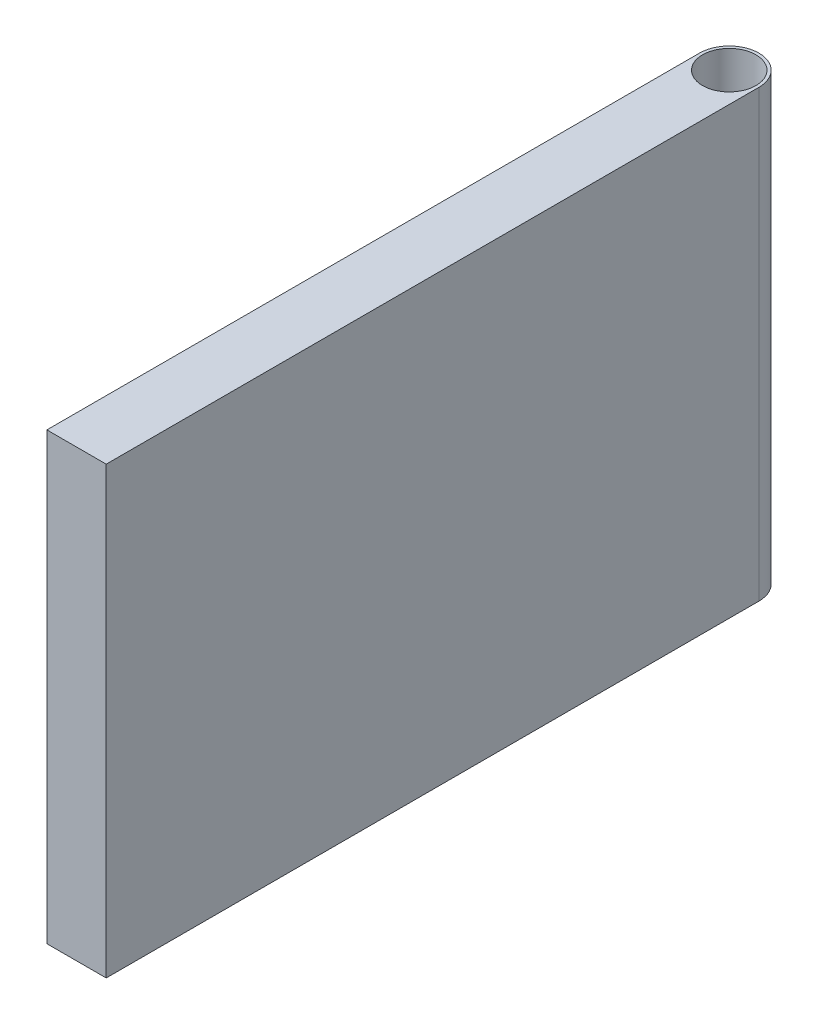
from build123d import *

# Parameters (mm, degrees)
SKETCH1_W           = 220
SKETCH1_H           = 150
BOSS_EXTRUDE2_DEPTH = 20
SKETCH3_R           = 10
SKETCH3_R_2         = 9
BOSS_EXTRUDE3_DEPTH = 150
SKETCH4_R           = 9
CUT_EXTRUDE1_DEPTH  = 150


with BuildPart() as part:
    # Sketch1 → Boss-Extrude2 (new body)
    with BuildSketch(Plane(origin=(0, 0, 0), x_dir=(0, 0, -1), z_dir=(1, 0, 0))):
        Rectangle(SKETCH1_W, SKETCH1_H)
    extrude(amount=BOSS_EXTRUDE2_DEPTH)

    # Sketch3 → Boss-Extrude3 (add)
    with BuildSketch(Plane(origin=(0, 75, 0), x_dir=(1, 0, 0), z_dir=(0, 1, 0))):
        with Locations((10, 110)):
            Circle(SKETCH3_R)
        with Locations((10, 110)):
            Circle(SKETCH3_R_2, mode=Mode.SUBTRACT)
    extrude(amount=-BOSS_EXTRUDE3_DEPTH)

    # Sketch4 → Cut-Extrude1 (cut)
    with BuildSketch(Plane(origin=(0, 75, 0), x_dir=(1, 0, 0), z_dir=(0, 1, 0))):
        with Locations(Location((10, 110, 0), (0, 0, 270))):
            Circle(SKETCH4_R)
    extrude(amount=-CUT_EXTRUDE1_DEPTH, mode=Mode.SUBTRACT)


solid = part.part
